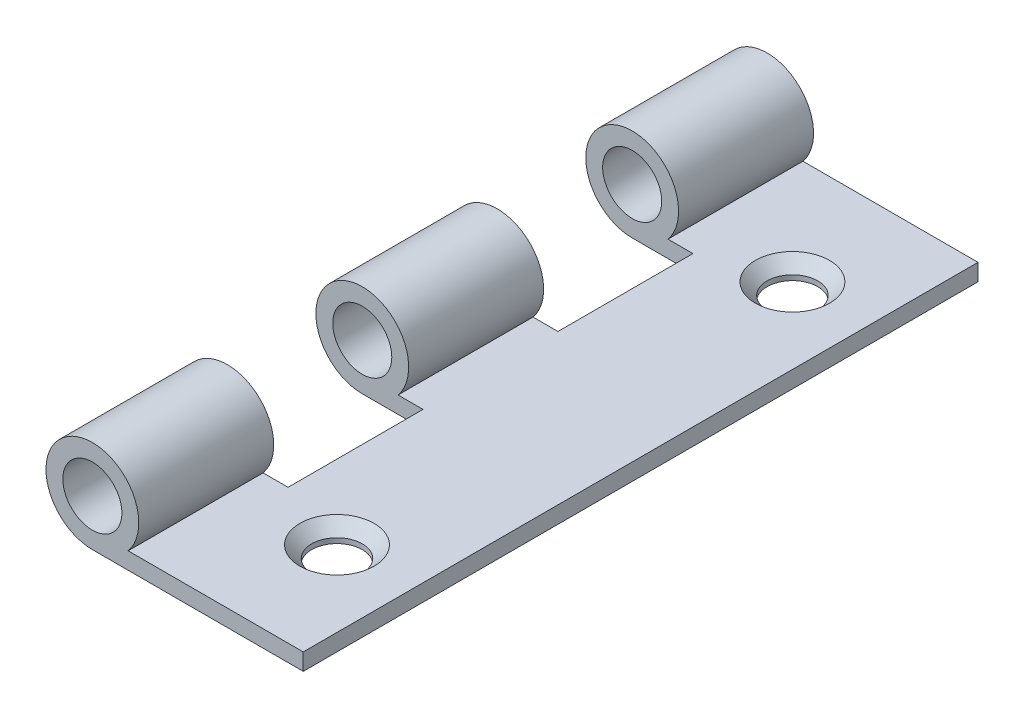
from build123d import *

# Parameters (mm, degrees)
ESQUISSE1_R                  = 1.75
BOSS_EXTRU_1_DEPTH           = 40
ENL_V_MAT_EXTRU_3_DEPTH      = 20
ENL_V_MAT_EXTRU_3_DEPTH_BACK = 20
ESQUISSE2_W                  = 17.8
ESQUISSE2_H                  = 8
D_GAGEMENT_M31_D             = 3
D_GAGEMENT_M31_DEPTH         = 10
D_GAGEMENT_M31_CSINK_D       = 4.4
D_GAGEMENT_M31_CSINK_ANGLE   = 90
D_GAGEMENT_M31_TIP           = 0.901290929


with BuildPart() as part:
    # Esquisse1 → Boss.-Extru.1 (new body)
    with BuildSketch(Plane.XY):
        with BuildLine():
            Line((12.5, -1.75), (2.121320344, -1.75))
            ThreePointArc((2.121320344, -1.75), (-1.17260394, 2.487468593), (0, -2.75))
            Line((0, -2.75), (12.5, -2.75))
            Line((12.5, -2.75), (12.5, -1.75))
        make_face()
        Circle(ESQUISSE1_R, mode=Mode.SUBTRACT)
    extrude(amount=BOSS_EXTRU_1_DEPTH)

    # Esquisse2 → Enlèv. mat.-Extru.3 (cut, two sides: drawn at the far end of the back side and taken through both)
    with BuildSketch(Plane(origin=(0, -1.75, 0), x_dir=(1, 0, 0), z_dir=(0, 1, 0)).offset(-ENL_V_MAT_EXTRU_3_DEPTH_BACK)):
        with Locations((-5.3, -12)):
            Rectangle(ESQUISSE2_W, ESQUISSE2_H)
        with Locations((-5.3, -28)):
            Rectangle(ESQUISSE2_W, ESQUISSE2_H)
    extrude(amount=ENL_V_MAT_EXTRU_3_DEPTH + ENL_V_MAT_EXTRU_3_DEPTH_BACK, mode=Mode.SUBTRACT)

    # Dégagement M31
    with Locations(Plane(origin=(0, -1.75, 0), x_dir=(1, 0, 0), z_dir=(0, 1, 0))):
        with Locations((8, -33.5), (8, -6.5)):
            CounterSinkHole(D_GAGEMENT_M31_D / 2, D_GAGEMENT_M31_CSINK_D / 2, depth=D_GAGEMENT_M31_DEPTH, counter_sink_angle=D_GAGEMENT_M31_CSINK_ANGLE)
            with Locations((0, 0, -(D_GAGEMENT_M31_DEPTH + D_GAGEMENT_M31_TIP / 2))):  # 118° drill point
                Cone(0, D_GAGEMENT_M31_D / 2, D_GAGEMENT_M31_TIP, mode=Mode.SUBTRACT)


solid = part.part
